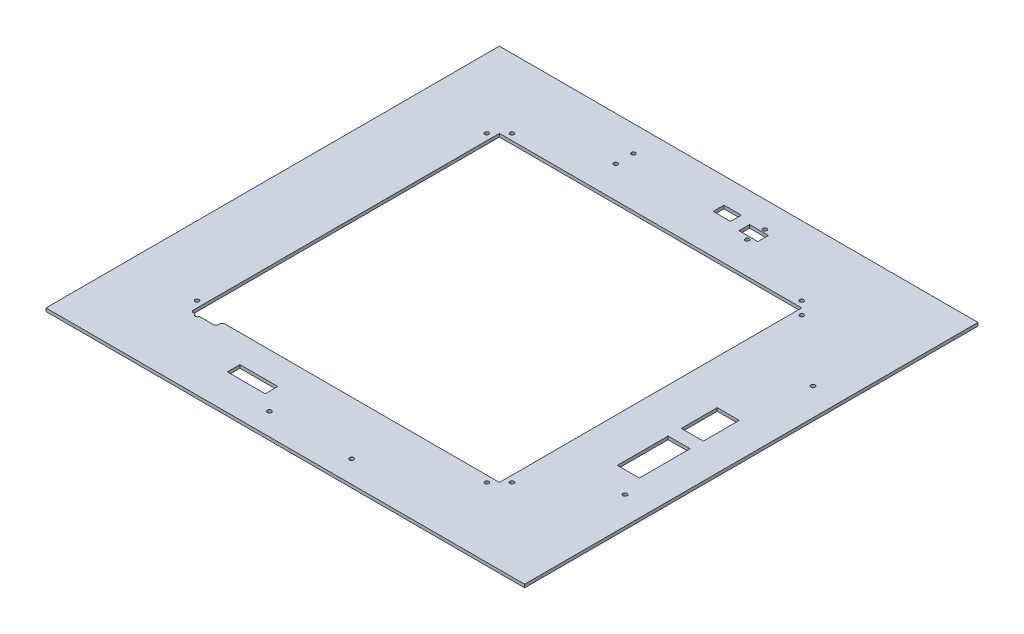
from build123d import *

# Parameters (mm, degrees)
SKETCH1_W           = 482.6
SKETCH1_H           = 457.2
SKETCH1_R           = 2
SKETCH1_W_2         = 38.1
SKETCH1_H_2         = 12.7
SKETCH1_R_2         = 2.1
SKETCH1_R_3         = 2.0955
SKETCH1_W_3         = 22.197164078
SKETCH1_H_3         = 51.155633978
SKETCH1_H_4         = 36.225516101
SKETCH1_W_4         = 17.438820998
SKETCH1_H_5         = 10.883645004
SKETCH1_W_5         = 19.05
SKETCH1_H_6         = 10.668
BOSS_EXTRUDE1_DEPTH = 3.175
FILLET1_R           = 2.54


with BuildPart() as part:
    # Sketch1 → Boss-Extrude1 (new body)
    with BuildSketch(Plane(origin=(0, 0, 0), x_dir=(1, 0, 0), z_dir=(0, 1, 0))):
        with Locations((-1.251503591, 0)):
            Rectangle(SKETCH1_W, SKETCH1_H)
        with Locations(Location((-172.733503591, -146.082, 0), (0, 0, 270))):
            Circle(SKETCH1_R, mode=Mode.SUBTRACT)
        with Locations((-76.181503591, -186.695610311)):
            Rectangle(SKETCH1_W_2, SKETCH1_H_2, mode=Mode.SUBTRACT)
        with Locations(Location((-39.643603591, -206.2861, 0), (0, 0, 270))):
            Circle(SKETCH1_R_2, mode=Mode.SUBTRACT)
        with BuildLine():
            Line((-166.351503591, -152.4), (-166.351503591, 152.4))
            Line((-166.351503591, 152.4), (138.448496409, 152.4))
            Line((138.448496409, 152.4), (138.448496409, -152.4))
            Line((138.448496409, -152.4), (-140.951503591, -152.4))
            Line((-140.951503591, -152.4), (-140.951503591, -158.75))
            Line((-140.951503591, -158.75), (-158.033759607, -158.75))
            ThreePointArc((-158.033759607, -158.75), (-158.033567596, -158.765999488), (-158.033503591, -158.782))
            ThreePointArc((-158.033503591, -158.782), (-160.049504103, -160.781935995), (-162.033247575, -158.75))
            Line((-162.033247575, -158.75), (-166.351503591, -158.75))
            Line((-166.351503591, -158.75), (-166.351503591, -152.4))
        make_face(mode=Mode.SUBTRACT)
        with Locations(Location((43.338196409, -206.2861, 0), (0, 0, 270))):
            Circle(SKETCH1_R_2, mode=Mode.SUBTRACT)
        with Locations(Location((132.130496409, -158.782, 0), (0, 0, 270))):
            Circle(SKETCH1_R, mode=Mode.SUBTRACT)
        with Locations(Location((144.830496409, -146.082, 0), (0, 0, 270))):
            Circle(SKETCH1_R, mode=Mode.SUBTRACT)
        with Locations(Location((212.390436409, -99.579800078, 0), (0, 0, 270))):
            Circle(SKETCH1_R_3, mode=Mode.SUBTRACT)
        with Locations((194.083935921, -52.428980659)):
            Rectangle(SKETCH1_W_3, SKETCH1_H_3, mode=Mode.SUBTRACT)
        with Locations(Location((-172.733503591, 146.082, 0), (0, 0, 270))):
            Circle(SKETCH1_R, mode=Mode.SUBTRACT)
        with Locations(Location((-160.033503591, 158.782, 0), (0, 0, 270))):
            Circle(SKETCH1_R, mode=Mode.SUBTRACT)
        with Locations(Location((-81.109103591, 184.531, 0), (0, 0, 270))):
            Circle(SKETCH1_R, mode=Mode.SUBTRACT)
        with Locations(Location((-81.109103591, 202.311, 0), (0, 0, 270))):
            Circle(SKETCH1_R, mode=Mode.SUBTRACT)
        with Locations((194.083935921, 4.575109653)):
            Rectangle(SKETCH1_W_3, SKETCH1_H_4, mode=Mode.SUBTRACT)
        with Locations(Location((212.390436409, 89.827999922, 0), (0, 0, 270))):
            Circle(SKETCH1_R_3, mode=Mode.SUBTRACT)
        with Locations((18.318465636, 197.512214728)):
            Rectangle(SKETCH1_W_4, SKETCH1_H_5, mode=Mode.SUBTRACT)
        with Locations(Location((51.351896409, 184.531, 0), (0, 0, 270))):
            Circle(SKETCH1_R, mode=Mode.SUBTRACT)
        with Locations((48.913496409, 193.548)):
            Rectangle(SKETCH1_W_5, SKETCH1_H_6, mode=Mode.SUBTRACT)
        with Locations(Location((51.351896409, 202.311, 0), (0, 0, 270))):
            Circle(SKETCH1_R, mode=Mode.SUBTRACT)
        with Locations(Location((144.830496409, 146.082, 0), (0, 0, 270))):
            Circle(SKETCH1_R, mode=Mode.SUBTRACT)
        with Locations(Location((132.130496409, 158.782, 0), (0, 0, 270))):
            Circle(SKETCH1_R, mode=Mode.SUBTRACT)
    extrude(amount=BOSS_EXTRUDE1_DEPTH)

    # Fillet1
    fillet1_edges = [part.edges().sort_by_distance(p)[0] for p in [
        (-140.951503591, 1.5875, 158.75),
        (-140.951503591, 1.5875, 152.4),
        (-166.351503591, 1.5875, 158.75),
    ]]
    fillet(fillet1_edges, radius=FILLET1_R)


solid = part.part
